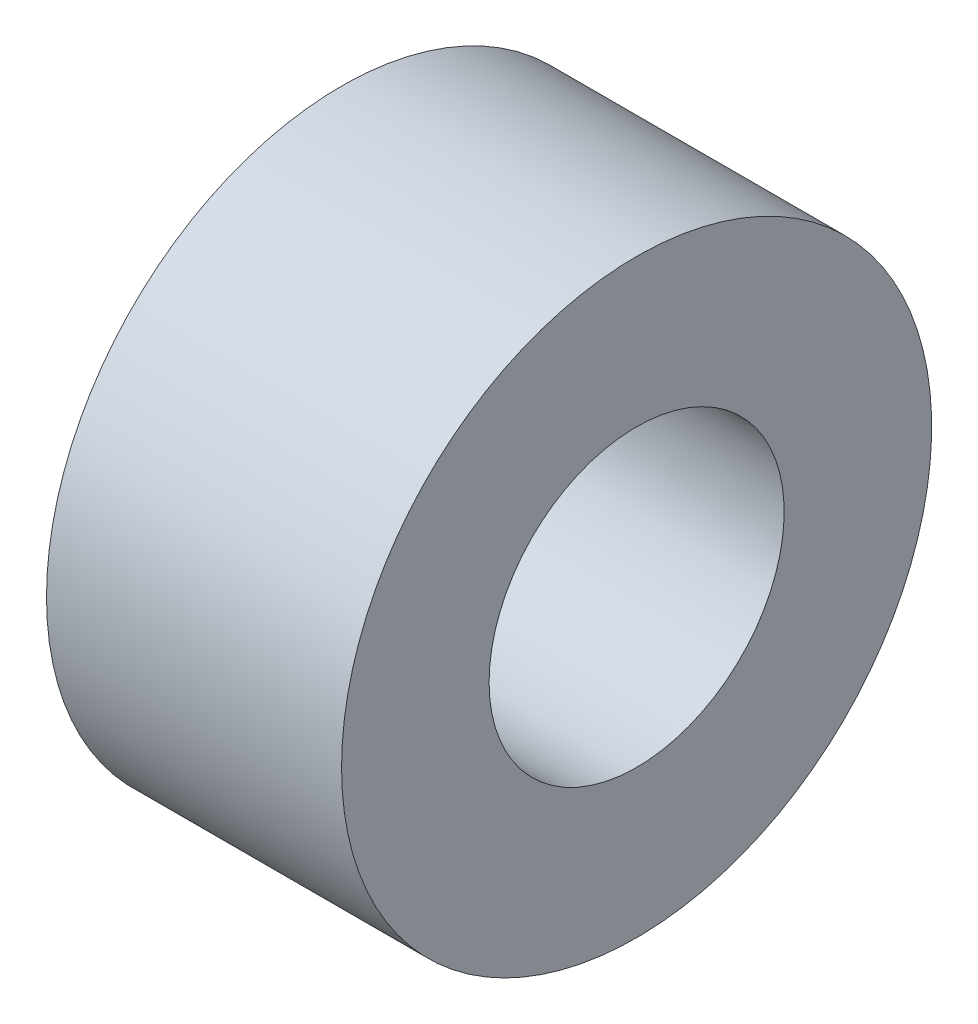
from build123d import *

# Parameters (mm, degrees)
SKETCH1_R           = 9.525
SKETCH1_R_2         = 4.7625
BOSS_EXTRUDE1_DEPTH = 9.525


with BuildPart() as part:
    # Sketch1 → Boss-Extrude1 (new body)
    with BuildSketch(Plane(origin=(0, 0, 0), x_dir=(0, 0, -1), z_dir=(1, 0, 0))):
        with Locations(Location((0, 0, 0), (0, 0, 180))):
            Circle(SKETCH1_R)
        with Locations(Location((0, 0, 0), (0, 0, 180))):
            Circle(SKETCH1_R_2, mode=Mode.SUBTRACT)
    extrude(amount=BOSS_EXTRUDE1_DEPTH)


solid = part.part
